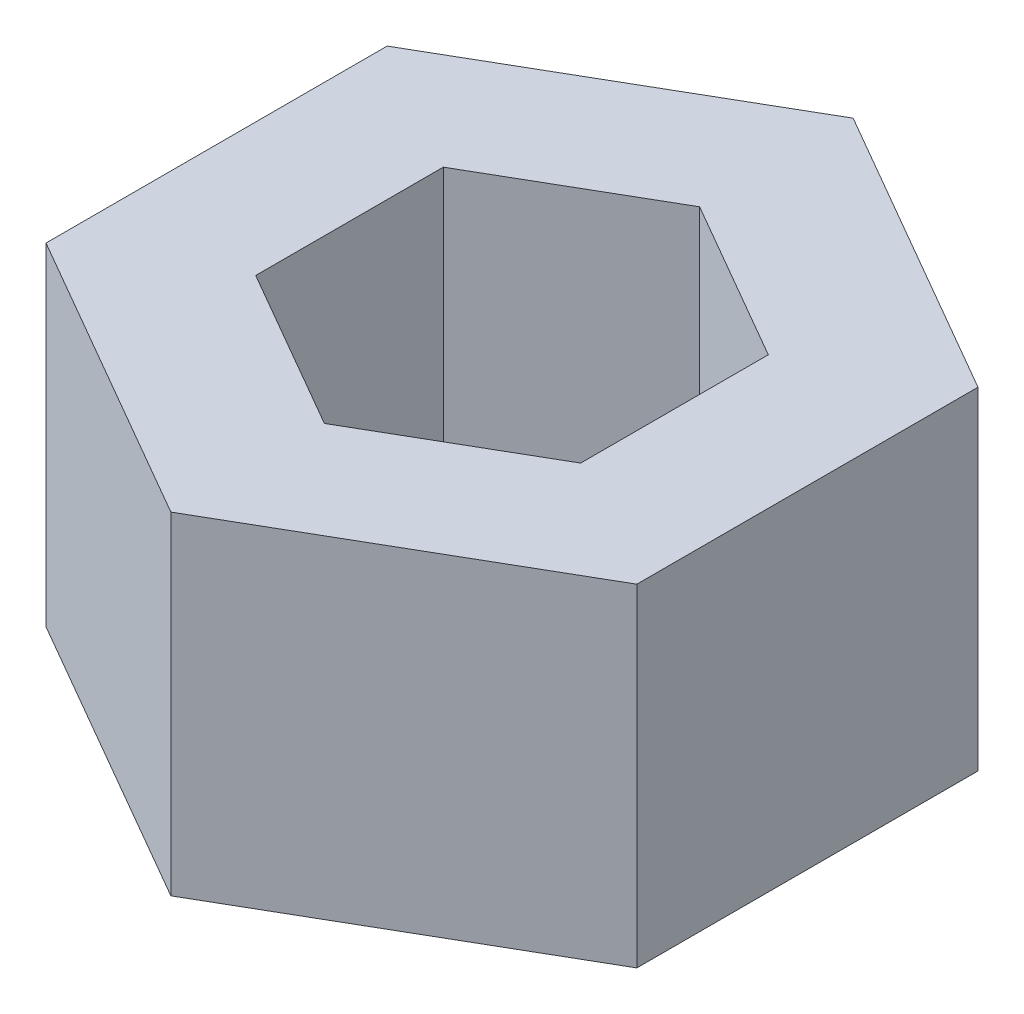
from build123d import *

# Parameters (mm, degrees)
BOSS_EXTRUDE1_DEPTH = 9


with BuildPart() as part:
    # Sketch2 → Boss-Extrude1 (new body)
    with BuildSketch(Plane(origin=(0, 0, 0), x_dir=(1, 0, 0), z_dir=(0, 1, 0))):
        Polygon((0, -9.237604307), (8, -4.618802154), (8, 4.618802154), (0, 9.237604307), (-8, 4.618802154), (-8, -4.618802154), align=None)
        Polygon((0, -5.080682369), (4.4, -2.540341184), (4.4, 2.540341184), (0, 5.080682369), (-4.4, 2.540341184), (-4.4, -2.540341184), align=None, mode=Mode.SUBTRACT)
    extrude(amount=BOSS_EXTRUDE1_DEPTH)


solid = part.part
